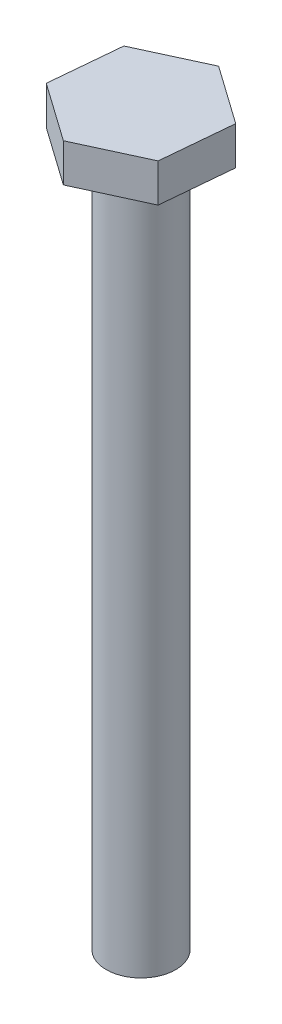
from build123d import *

# Parameters (mm, degrees)
SKETCH2_R           = 6.35
BOSS_EXTRUDE1_DEPTH = 127
BOSS_EXTRUDE2_DEPTH = 7


with BuildPart() as part:
    # Sketch2 → Boss-Extrude1 (new body)
    with BuildSketch(Plane(origin=(0, 0, 0), x_dir=(1, 0, 0), z_dir=(0, 1, 0))):
        with Locations(Location((0, 0, 0), (0, 0, 270))):
            Circle(SKETCH2_R)
    extrude(amount=-BOSS_EXTRUDE1_DEPTH)

    # Sketch3 → Boss-Extrude2 (add)
    with BuildSketch(Plane(origin=(0, 0, 0), x_dir=(1, 0, 0), z_dir=(0, 1, 0))):
        Polygon((10.661729582, -7.533342667), (11.854930916, 5.466657333), (1.193201334, 13), (-10.661729582, 7.533342667), (-11.854930916, -5.466657333), (-1.193201334, -13), align=None)
    extrude(amount=BOSS_EXTRUDE2_DEPTH)


solid = part.part
